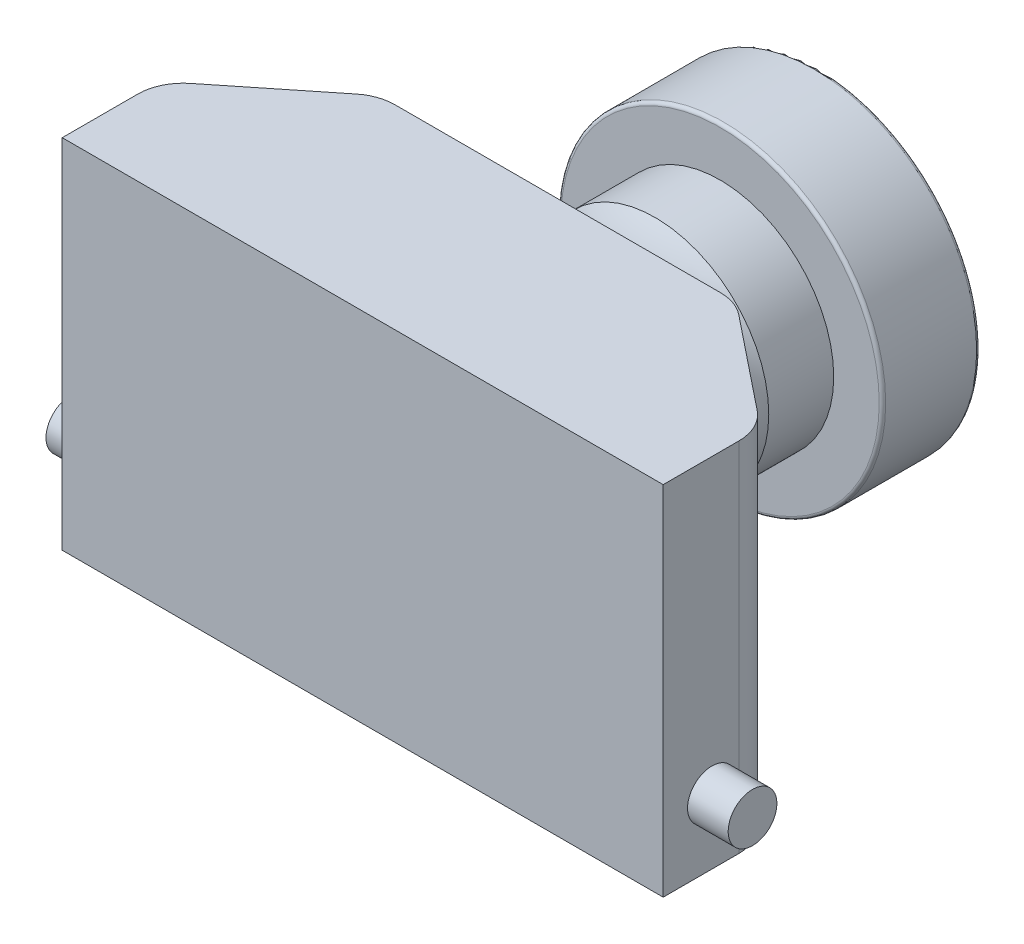
from build123d import *

# Parameters (mm, degrees)
Y_KSEKLIK_EKSTR_ZYON1_DEPTH = 5.5
IZIM4_R                     = 0.75
Y_KSEKLIK_EKSTR_ZYON2_DEPTH = 10.5
RADYUS1_R                   = 0.1
RADYUS2_R                   = 1.4


with BuildPart() as part:
    # Çizim1 → Yükseklik-Ekstrüzyon1 (new, symmetric)
    with BuildSketch(Plane(origin=(0, 0, 0), x_dir=(1, 0, 0), z_dir=(0, 1, 0))):
        Polygon((-9.25, 0), (9.25, 0), (9.25, 3), (5.5, 6), (-5.5, 6), (-9.25, 3), align=None)
    extrude(amount=Y_KSEKLIK_EKSTR_ZYON1_DEPTH, both=True)

    # Çizim2 → Döndür1 (revolve)
    with BuildSketch(Plane(origin=(0, 0, 0), x_dir=(1, 0, 0), z_dir=(0, 1, 0))):
        with BuildLine():
            Line((0, 6), (0, 13.8))
            Line((0, 13.8), (4.5, 13.8))
            Line((4.5, 13.8), (4.5, 14))
            Line((4.5, 14), (5, 14))
            Line((5, 14), (5, 11))
            Line((5, 11), (3.5, 11))
            Line((3.5, 11), (3.5, 9))
            ThreePointArc((3.5, 9), (3.465409062, 7.321803021), (4.5, 6))
            Line((4.5, 6), (0, 6))
        make_face()
    revolve(axis=Axis((0, 0, 0), (0, 0, -1)))

    # Çizim3 → Döndür2 (revolve)
    with BuildSketch(Plane(origin=(0, 0, 0), x_dir=(1, 0, 0), z_dir=(0, 1, 0))):
        with BuildLine():
            Line((0, 13.8), (4.75, 13.8))
            Line((4.75, 13.8), (4.75, 14))
            ThreePointArc((4.75, 14), (2.417928436, 14.654887588), (0, 14.8))
            Line((0, 14.8), (0, 13.8))
        make_face()
    revolve(axis=Axis((0, 0, 0), (0, 0, -1)))

    # Çizim4 → Yükseklik-Ekstrüzyon2 (add, symmetric)
    with BuildSketch(Plane(origin=(0, 0, 0), x_dir=(0, 0, -1), z_dir=(1, 0, 0))):
        with Locations(Location((1.5, -3.5, 0), (0, 0, 180))):
            Circle(IZIM4_R)
    extrude(amount=Y_KSEKLIK_EKSTR_ZYON2_DEPTH, both=True)

    # Radyus1
    radyus1_edges = [part.edges().sort_by_distance(p)[0] for p in [
        (-5, 0, -11),
        (-5, 0, -14),
        (-4.75, 0, -14),
    ]]
    fillet(radyus1_edges, radius=RADYUS1_R)

    # Radyus2
    radyus2_edges = [part.edges().sort_by_distance(p)[0] for p in [
        (-9.25, 0, -3),
        (-5.5, 0, -6),
        (5.5, 0, -6),
        (9.25, 0, -3),
    ]]
    fillet(radyus2_edges, radius=RADYUS2_R)


solid = part.part
